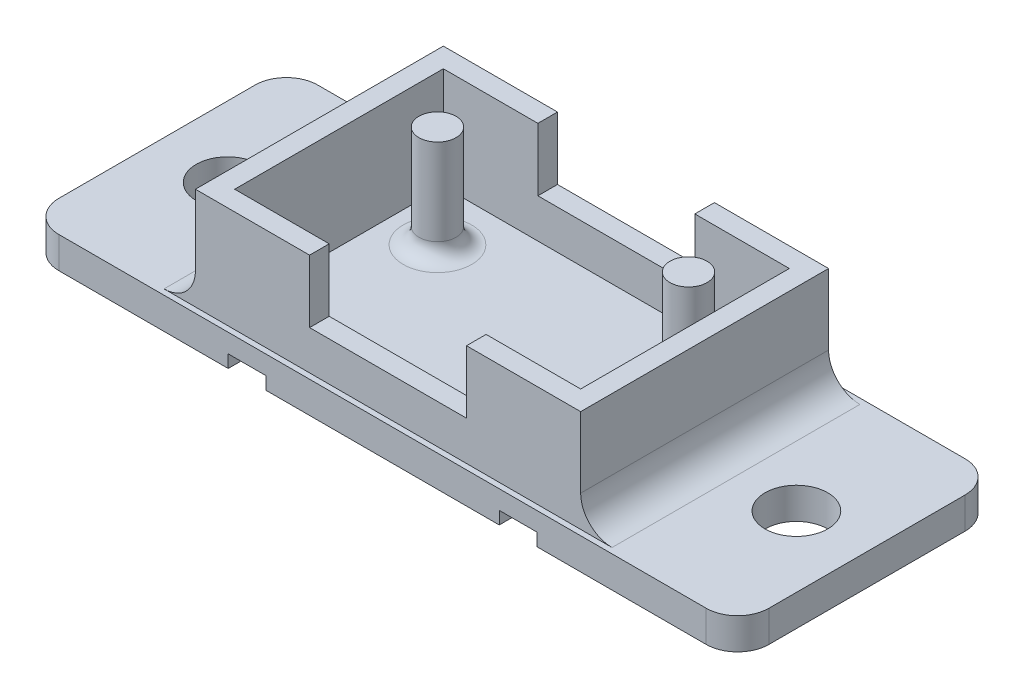
from build123d import *

# Parameters (mm, degrees)
SKETCH1_W               = 32.0675
SKETCH1_H               = 20.955
BOSS_EXTRUDE2_DEPTH     = 2.54
SKETCH3_W               = 31.1785
SKETCH3_H               = 20.066
SKETCH3_W_2             = 28.0035
SKETCH3_H_2             = 16.891
EXTRUDE_THIN1_DEPTH     = 8.255
CUT_EXTRUDE1_DEPTH      = 29.508335431
CUT_EXTRUDE1_DEPTH_BACK = 29.508335431
SKETCH4_W               = 12.7
SKETCH4_H               = 5.08
SKETCH5_R               = 1.5
BOSS_EXTRUDE3_DEPTH     = 8.255
FILLET1_R               = 1.27
CUT_EXTRUDE2_DEPTH      = 29.508335431
CUT_EXTRUDE2_DEPTH_BACK = 29.508335431
SKETCH6_W               = 3.048
SKETCH6_H               = 1.02616
SKETCH7_W               = 20.955
SKETCH7_H               = 2.54
BOSS_EXTRUDE4_DEPTH     = 12.7
FILLET2_R               = 2.54
FILLET3_R               = 2.54
SKETCH8_R               = 2.54
CUT_EXTRUDE3_DEPTH      = 32.67887972
FILLET4_R               = 2.54


with BuildPart() as part:
    # Sketch1 → Boss-Extrude2 (new body)
    with BuildSketch(Plane(origin=(0, 0, 0), x_dir=(1, 0, 0), z_dir=(0, 1, 0))):
        Rectangle(SKETCH1_W, SKETCH1_H)
    extrude(amount=BOSS_EXTRUDE2_DEPTH)

    # Sketch3 → Extrude-Thin1 (add)
    with BuildSketch(Plane(origin=(0, 2.54, 0), x_dir=(1, 0, 0), z_dir=(0, 1, 0))):
        Rectangle(SKETCH3_W, SKETCH3_H)
        Rectangle(SKETCH3_W_2, SKETCH3_H_2, mode=Mode.SUBTRACT)
    extrude(amount=EXTRUDE_THIN1_DEPTH)

    # Sketch4 → Cut-Extrude1 (cut, two sides: drawn at the far end of the back side and taken through both)
    with BuildSketch(Plane(origin=(0, 0, -10.4775), x_dir=(-1, 0, 0), z_dir=(0, 0, -1)).offset(-CUT_EXTRUDE1_DEPTH_BACK)):
        with Locations((0, 8.255)):
            Rectangle(SKETCH4_W, SKETCH4_H)
    extrude(amount=CUT_EXTRUDE1_DEPTH + CUT_EXTRUDE1_DEPTH_BACK, mode=Mode.SUBTRACT)

    # Sketch5 → Boss-Extrude3 (add)
    with BuildSketch(Plane(origin=(0, 2.54, 0), x_dir=(1, 0, 0), z_dir=(0, 1, 0))):
        with Locations(Location((-10.16, 4.1275, 0), (0, 0, 270))):
            Circle(SKETCH5_R)
        with Locations(Location((10.16, 4.1275, 0), (0, 0, 90))):
            Circle(SKETCH5_R)
    extrude(amount=BOSS_EXTRUDE3_DEPTH)

    # Fillet1
    fillet1_edges = [part.edges().sort_by_distance(p)[0] for p in [
        (-10.16, 2.54, -5.6275),
        (10.16, 2.54, -2.6275),
    ]]
    fillet(fillet1_edges, radius=FILLET1_R)

    # Sketch6 → Cut-Extrude2 (cut, two sides: drawn at the far end of the back side and taken through both)
    with BuildSketch(Plane.XY.offset(10.4775).offset(-CUT_EXTRUDE2_DEPTH_BACK)):
        with Locations((-10.969625, 0.51308)):
            Rectangle(SKETCH6_W, SKETCH6_H)
        with Locations((10.969625, 0.51308)):
            Rectangle(SKETCH6_W, SKETCH6_H)
    extrude(amount=CUT_EXTRUDE2_DEPTH + CUT_EXTRUDE2_DEPTH_BACK, mode=Mode.SUBTRACT)

    # Sketch7 → Boss-Extrude4 (add)
    with BuildSketch(Plane.ZY.offset(16.03375)):
        with Locations((0, 1.27)):
            Rectangle(SKETCH7_W, SKETCH7_H)
    boss_extrude4 = extrude(amount=BOSS_EXTRUDE4_DEPTH)

    # Fillet2
    fillet2_edges = [part.edges().sort_by_distance(p)[0] for p in [
        (-28.73375, 1.27, -10.4775),
        (-28.73375, 1.27, 10.4775),
    ]]
    fillet(fillet2_edges, radius=FILLET2_R)

    # Fillet3
    fillet3_edges = [part.edges().sort_by_distance(p)[0] for p in [
        (-15.58925, 2.54, 0),
    ]]
    fillet(fillet3_edges, radius=FILLET3_R)

    # Sketch8 → Cut-Extrude3 (cut, symmetric)
    with BuildSketch(Plane(origin=(0, 2.54, 0), x_dir=(1, 0, 0), z_dir=(0, 1, 0))):
        with Locations(Location((-23.01875, 0, 0), (0, 0, 270))):
            Circle(SKETCH8_R)
    cut_extrude3 = extrude(amount=CUT_EXTRUDE3_DEPTH, both=True, mode=Mode.SUBTRACT)

    # Mirror2: Boss-Extrude4 across plane
    add(boss_extrude4.mirror(Plane(origin=(0, 0, 0), x_dir=(0, 0, 1), z_dir=(1, 0, 0))))

    # Mirror6: Cut-Extrude3 across plane
    add(cut_extrude3.mirror(Plane(origin=(0, 0, 0), x_dir=(0, 0, 1), z_dir=(1, 0, 0))), mode=Mode.SUBTRACT)

    # Fillet4
    fillet4_edges = [part.edges().sort_by_distance(p)[0] for p in [
        (28.73375, 1.27, -10.4775),
        (28.73375, 1.27, 10.4775),
        (15.58925, 2.54, 0),
    ]]
    fillet(fillet4_edges, radius=FILLET4_R)


solid = part.part
